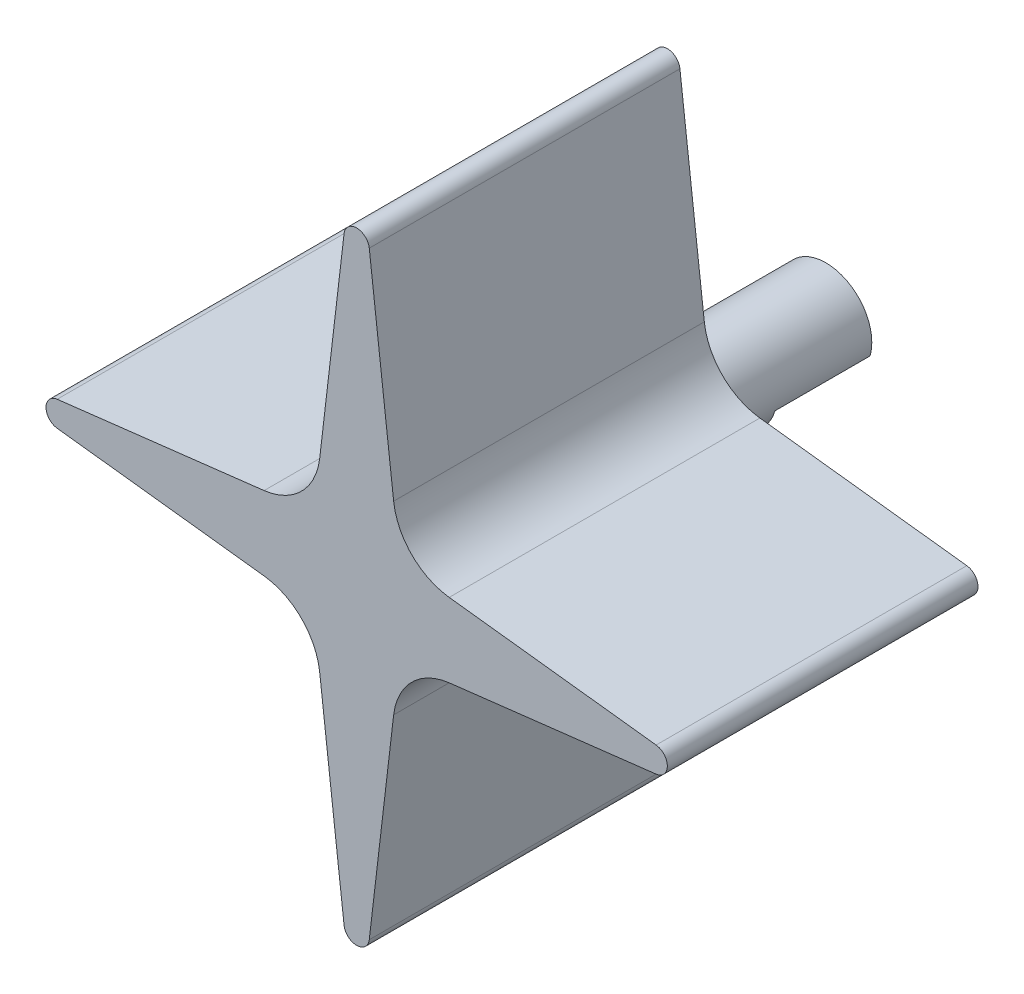
from build123d import *

# Parameters (mm, degrees)
SKETCH1_R           = 7.5
BOSS_EXTRUDE1_DEPTH = 49
FILLET1_R           = 10
SKETCH2_R           = 7.25
BOSS_EXTRUDE2_DEPTH = 25
CUT_EXTRUDE1_START  = -15
CUT_EXTRUDE1_DEPTH  = 15


with BuildPart() as part:
    # Sketch1 → Boss-Extrude1 (new body)
    with BuildSketch(Plane.XY):
        with BuildLine():
            ThreePointArc((-7.448470559, -0.877659574), (-7.5, 0), (-7.448470559, 0.877659574))
            Line((-7.448470559, 0.877659574), (-6.755839639, 6.755839639))
            Line((-6.755839639, 6.755839639), (-47.234042553, 1.986258816))
            ThreePointArc((-47.234042553, 1.986258816), (-49, 0), (-47.234042553, -1.986258816))
            Line((-47.234042553, -1.986258816), (-6.755839639, -6.755839639))
            Line((-6.755839639, -6.755839639), (-7.448470559, -0.877659574))
        make_face()
        with BuildLine():
            Line((-1.986258816, 47.234042553), (-6.755839639, 6.755839639))
            Line((-6.755839639, 6.755839639), (-0.877659574, 7.448470559))
            ThreePointArc((-0.877659574, 7.448470559), (0, 7.5), (0.877659574, 7.448470559))
            Line((0.877659574, 7.448470559), (6.755839639, 6.755839639))
            Line((6.755839639, 6.755839639), (1.986258816, 47.234042553))
            ThreePointArc((1.986258816, 47.234042553), (0, 49), (-1.986258816, 47.234042553))
        make_face()
        with BuildLine():
            Line((47.234042553, 1.986258816), (6.755839639, 6.755839639))
            Line((6.755839639, 6.755839639), (7.448470559, 0.877659574))
            ThreePointArc((7.448470559, 0.877659574), (7.487106557, 0.43958549), (7.5, 0))
            ThreePointArc((7.5, 0), (7.487106557, -0.43958549), (7.448470559, -0.877659574))
            Line((7.448470559, -0.877659574), (6.755839639, -6.755839639))
            Line((6.755839639, -6.755839639), (47.234042553, -1.986258816))
            ThreePointArc((47.234042553, -1.986258816), (49, 0), (47.234042553, 1.986258816))
        make_face()
        with BuildLine():
            Line((-0.877659574, -7.448470559), (-6.755839639, -6.755839639))
            Line((-6.755839639, -6.755839639), (-1.986258816, -47.234042553))
            ThreePointArc((-1.986258816, -47.234042553), (0, -49), (1.986258816, -47.234042553))
            Line((1.986258816, -47.234042553), (6.755839639, -6.755839639))
            Line((6.755839639, -6.755839639), (0.877659574, -7.448470559))
            ThreePointArc((0.877659574, -7.448470559), (0, -7.5), (-0.877659574, -7.448470559))
        make_face()
        with BuildLine():
            Line((-6.755839639, 6.755839639), (-7.448470559, 0.877659574))
            ThreePointArc((-7.448470559, 0.877659574), (-5.303300859, 5.303300859), (-0.877659574, 7.448470559))
            Line((-0.877659574, 7.448470559), (-6.755839639, 6.755839639))
        make_face()
        Circle(SKETCH1_R)
        with BuildLine():
            Line((6.755839639, 6.755839639), (0.877659574, 7.448470559))
            ThreePointArc((0.877659574, 7.448470559), (5.303300859, 5.303300859), (7.448470559, 0.877659574))
            Line((7.448470559, 0.877659574), (6.755839639, 6.755839639))
        make_face()
        with BuildLine():
            ThreePointArc((7.448470559, -0.877659574), (5.303300859, -5.303300859), (0.877659574, -7.448470559))
            Line((0.877659574, -7.448470559), (6.755839639, -6.755839639))
            Line((6.755839639, -6.755839639), (7.448470559, -0.877659574))
        make_face()
        with BuildLine():
            ThreePointArc((-0.877659574, -7.448470559), (-5.303300859, -5.303300859), (-7.448470559, -0.877659574))
            Line((-7.448470559, -0.877659574), (-6.755839639, -6.755839639))
            Line((-6.755839639, -6.755839639), (-0.877659574, -7.448470559))
        make_face()
    extrude(amount=BOSS_EXTRUDE1_DEPTH)

    # Fillet1
    fillet1_edges = [part.edges().sort_by_distance(p)[0] for p in [
        (6.755839639, 6.755839639, 24.5),
        (6.755839639, -6.755839639, 24.5),
        (-6.755839639, -6.755839639, 24.5),
        (-6.755839639, 6.755839639, 24.5),
    ]]
    fillet(fillet1_edges, radius=FILLET1_R)

    # Sketch2 → Boss-Extrude2 (add)
    with BuildSketch(Plane(origin=(0, 0, 0), x_dir=(-1, 0, 0), z_dir=(0, 0, -1))):
        with Locations(Location((0, 0, 0), (0, 0, 180))):
            Circle(SKETCH2_R)
    extrude(amount=BOSS_EXTRUDE2_DEPTH)

    # Sketch3 → Cut-Extrude1 (cut)
    with BuildSketch(Plane(origin=(0, 0, -25), x_dir=(-1, 0, 0), z_dir=(0, 0, -1)).offset(CUT_EXTRUDE1_START)):
        with BuildLine():
            Line((6.968679932, -2), (-6.968679932, -2))
            ThreePointArc((-6.968679932, -2), (0, -7.25), (6.968679932, -2))
        make_face()
    extrude(amount=CUT_EXTRUDE1_DEPTH, mode=Mode.SUBTRACT)


solid = part.part
